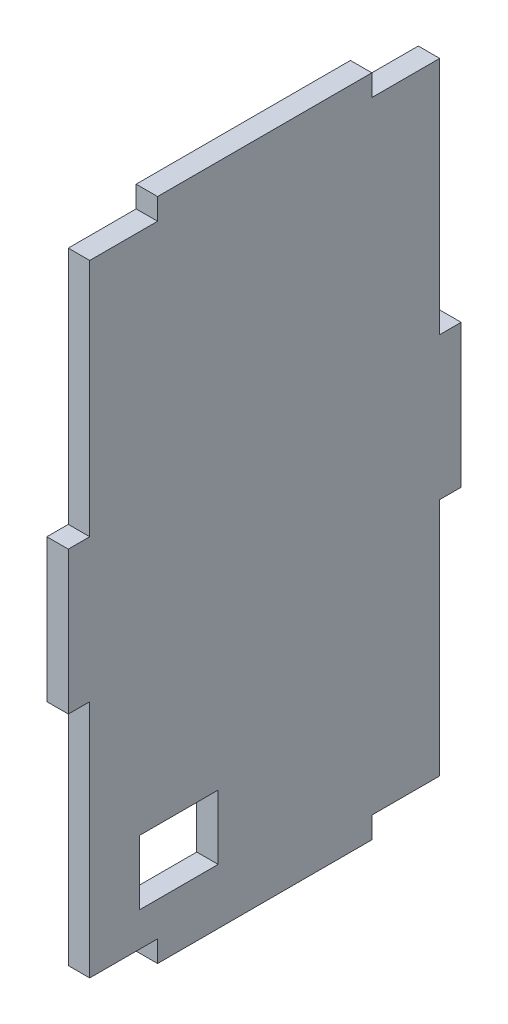
from build123d import *

# Parameters (mm, degrees)
SKETCH2_W           = 55
SKETCH2_H           = 93
BOSS_EXTRUDE1_DEPTH = 3
SKETCH3_W           = 10.997747865
SKETCH3_H           = 9.016820523
CUT_EXTRUDE1_DEPTH  = 3


with BuildPart() as part:
    # Sketch2 → Boss-Extrude1 (new body)
    with BuildSketch(Plane(origin=(0, 0, 0), x_dir=(0, 0, -1), z_dir=(1, 0, 0))):
        Rectangle(SKETCH2_W, SKETCH2_H)
    extrude(amount=BOSS_EXTRUDE1_DEPTH)

    # Sketch3 → Cut-Extrude1 (cut)
    with BuildSketch(Plane(origin=(3, 0, 0), x_dir=(0, 0, -1), z_dir=(1, 0, 0))):
        Polygon((-27.5, 46.5), (-24.5, 46.5), (-15, 46.5), (-15, 43.5), (-24.5, 43.5), (-24.5, 10), (-27.5, 10), align=None)
        Polygon((27.5, 46.5), (27.5, 10), (24.5, 10), (24.5, 43.5), (15, 43.5), (15, 46.5), (24.5, 46.5), align=None)
        Polygon((27.5, -46.5), (24.5, -46.5), (15, -46.5), (15, -43.5), (24.5, -43.5), (24.5, -10), (27.5, -10), align=None)
        Polygon((-27.5, -46.5), (-27.5, -10), (-24.5, -10), (-24.5, -43.5), (-15, -43.5), (-15, -46.5), (-24.5, -46.5), align=None)
        with Locations((-12.014032646, -34.210673658)):
            Rectangle(SKETCH3_W, SKETCH3_H)
    extrude(amount=-CUT_EXTRUDE1_DEPTH, mode=Mode.SUBTRACT)


solid = part.part
